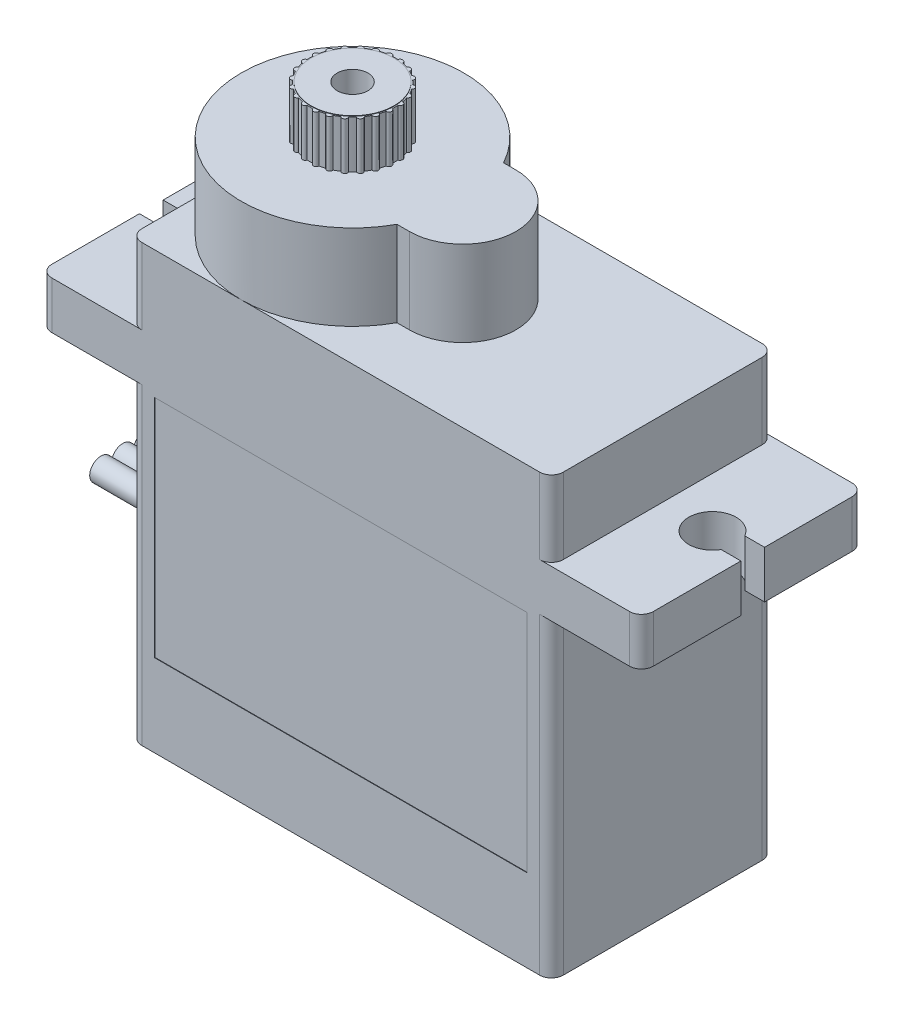
from build123d import *

# Parameters (mm, degrees)
SKETCH1_W               = 22.606
SKETCH1_H               = 11.938
BOSS_EXTRUDE1_DEPTH     = 23.368
SKETCH3_W               = 11.938
SKETCH3_H               = 2.54
BOSS_EXTRUDE2_DEPTH     = 16.129
BOSS_EXTRUDE3_DEPTH     = 4.572
CUT_EXTRUDE1_DEPTH      = 26.853781503
CUT_EXTRUDE1_DEPTH_BACK = 26.853781503
SKETCH6_R               = 2.413
SKETCH6_R_2             = 2.286
SKETCH6_R_3             = 0.8255
BOSS_EXTRUDE4_DEPTH     = 2.54
CUT_EXTRUDE2_START      = -2.54
CUT_EXTRUDE2_DEPTH      = 2.54
SKETCH9_R               = 2.2225
SKETCH9_R_2             = 0.8255
BOSS_EXTRUDE5_DEPTH     = 0.0254
FILLET1_R               = 0.635
FILLET2_R               = 0.635
SKETCH10_R              = 0.98425
CUT_EXTRUDE3_DEPTH      = 2.54
SKETCH11_R              = 0.60325
BOSS_EXTRUDE7_DEPTH     = 6.35
SKETCH13_W              = 19.9898
SKETCH13_H              = 12.0904
CUT_EXTRUDE4_DEPTH      = 0.0254


with BuildPart() as part:
    # Sketch1 → Boss-Extrude1 (new body)
    with BuildSketch(Plane(origin=(0, 0, 0), x_dir=(1, 0, 0), z_dir=(0, 1, 0))):
        Rectangle(SKETCH1_W, SKETCH1_H)
    extrude(amount=BOSS_EXTRUDE1_DEPTH)

    # Sketch3 → Boss-Extrude2 (add, symmetric)
    with BuildSketch(Plane(origin=(0, 0, 0), x_dir=(0, 0, -1), z_dir=(1, 0, 0))):
        with Locations((0, 18.034)):
            Rectangle(SKETCH3_W, SKETCH3_H)
    extrude(amount=BOSS_EXTRUDE2_DEPTH, both=True)

    # Sketch4 → Boss-Extrude3 (add)
    with BuildSketch(Plane(origin=(0, 23.368, 0), x_dir=(1, 0, 0), z_dir=(0, 1, 0))):
        with BuildLine():
            Line((0.5715, 2.8575), (-0.093422289, 2.8575))
            ThreePointArc((-0.093422289, 2.8575), (-11.303, 0), (-0.093422289, -2.8575))
            Line((-0.093422289, -2.8575), (0.5715, -2.8575))
            ThreePointArc((0.5715, -2.8575), (3.429, 0), (0.5715, 2.8575))
        make_face()
    extrude(amount=BOSS_EXTRUDE3_DEPTH)

    # Sketch5 → Cut-Extrude1 (cut, two sides: drawn at the far end of the back side and taken through both)
    with BuildSketch(Plane(origin=(0, 19.304, 0), x_dir=(1, 0, 0), z_dir=(0, 1, 0)).offset(-CUT_EXTRUDE1_DEPTH_BACK)):
        with BuildLine():
            ThreePointArc((-15.069852263, 0.635), (-12.7, 0), (-15.069852263, -0.635))
            Line((-15.069852263, -0.635), (-16.129, -0.635))
            Line((-16.129, -0.635), (-16.129, 0.635))
            Line((-16.129, 0.635), (-15.069852263, 0.635))
        make_face()
        with BuildLine():
            Line((16.129, -0.635), (16.129, 0.635))
            Line((16.129, 0.635), (15.069852263, 0.635))
            ThreePointArc((15.069852263, 0.635), (12.7, 0), (15.069852263, -0.635))
            Line((15.069852263, -0.635), (16.129, -0.635))
        make_face()
    extrude(amount=CUT_EXTRUDE1_DEPTH + CUT_EXTRUDE1_DEPTH_BACK, mode=Mode.SUBTRACT)

    # Sketch6 → Boss-Extrude4 (add)
    # profile 1 of 2: a face of its own
    with BuildSketch(Plane(origin=(0, 27.94, 0), x_dir=(1, 0, 0), z_dir=(0, 1, 0))):
        with Locations(Location((-5.334, 0, 0), (0, 0, 90))):
            Circle(SKETCH6_R)
        with Locations((-5.334, 0)):
            Circle(SKETCH6_R_2, mode=Mode.SUBTRACT)
    # profile 2 of 2: a face of its own
    with BuildSketch(Plane(origin=(0, 27.94, 0), x_dir=(1, 0, 0), z_dir=(0, 1, 0))):
        with Locations((-5.334, 0)):
            Circle(SKETCH6_R_2)
        with Locations(Location((-5.334, 0, 0), (0, 0, 90))):
            Circle(SKETCH6_R_3, mode=Mode.SUBTRACT)
    extrude(amount=BOSS_EXTRUDE4_DEPTH)

    # Sketch8 → Cut-Extrude2 (cut)
    with BuildSketch(Plane(origin=(0, 30.48, 0), x_dir=(1, 0, 0), z_dir=(0, 1, 0)).offset(CUT_EXTRUDE2_START)):
        with BuildLine():
            ThreePointArc((-6.841264533, 1.7187058), (-6.859086333, 1.823777663), (-6.802941328, 1.91436161))
            ThreePointArc((-6.802941328, 1.91436161), (-7.040248663, 1.706248663), (-7.24836161, 1.468941328))
            ThreePointArc((-7.24836161, 1.468941328), (-7.157777663, 1.525086333), (-7.0527058, 1.507264533))
            ThreePointArc((-7.0527058, 1.507264533), (-6.950446102, 1.616446102), (-6.841264533, 1.7187058))
        make_face()
        with BuildLine():
            ThreePointArc((-7.234739534, 1.270033553), (-7.279148669, 1.366912558), (-7.24836161, 1.468941328))
            ThreePointArc((-7.24836161, 1.468941328), (-7.423719299, 1.2065), (-7.563321312, 0.923415122))
            ThreePointArc((-7.563321312, 0.923415122), (-7.490355335, 1.001091883), (-7.384251087, 1.011071946))
            ThreePointArc((-7.384251087, 1.011071946), (-7.313734073, 1.143), (-7.234739534, 1.270033553))
        make_face()
        with BuildLine():
            ThreePointArc((-7.498682276, 0.734810618), (-7.566652339, 0.816894621), (-7.563321312, 0.923415122))
            ThreePointArc((-7.563321312, 0.923415122), (-7.664779019, 0.624530356), (-7.72635645, 0.314959702))
            ThreePointArc((-7.72635645, 0.314959702), (-7.675980953, 0.408874675), (-7.576075151, 0.445976476))
            ThreePointArc((-7.576075151, 0.445976476), (-7.542106439, 0.591660337), (-7.498682276, 0.734810618))
        make_face()
        with BuildLine():
            ThreePointArc((-7.615105499, 0.149511553), (-7.702004441, 0.211206665), (-7.72635645, 0.314959702))
            ThreePointArc((-7.72635645, 0.314959702), (-7.747, 0), (-7.72635645, -0.314959702))
            ThreePointArc((-7.72635645, -0.314959702), (-7.702004441, -0.211206665), (-7.615105499, -0.149511553))
            ThreePointArc((-7.615105499, -0.149511553), (-7.62, 0), (-7.615105499, 0.149511553))
        make_face()
        with BuildLine():
            ThreePointArc((-7.576075151, -0.445976476), (-7.675980953, -0.408874675), (-7.72635645, -0.314959702))
            ThreePointArc((-7.72635645, -0.314959702), (-7.664779019, -0.624530356), (-7.563321312, -0.923415122))
            ThreePointArc((-7.563321312, -0.923415122), (-7.566652339, -0.816894621), (-7.498682276, -0.734810618))
            ThreePointArc((-7.498682276, -0.734810618), (-7.542106439, -0.591660337), (-7.576075151, -0.445976476))
        make_face()
        with BuildLine():
            ThreePointArc((-7.384251087, -1.011071946), (-7.490355335, -1.001091883), (-7.563321312, -0.923415122))
            ThreePointArc((-7.563321312, -0.923415122), (-7.423719299, -1.2065), (-7.24836161, -1.468941328))
            ThreePointArc((-7.24836161, -1.468941328), (-7.279148669, -1.366912558), (-7.234739534, -1.270033553))
            ThreePointArc((-7.234739534, -1.270033553), (-7.313734073, -1.143), (-7.384251087, -1.011071946))
        make_face()
        with BuildLine():
            ThreePointArc((-7.0527058, -1.507264533), (-7.157777663, -1.525086333), (-7.24836161, -1.468941328))
            ThreePointArc((-7.24836161, -1.468941328), (-7.040248663, -1.706248663), (-6.802941328, -1.91436161))
            ThreePointArc((-6.802941328, -1.91436161), (-6.859086333, -1.823777663), (-6.841264533, -1.7187058))
            ThreePointArc((-6.841264533, -1.7187058), (-6.950446102, -1.616446102), (-7.0527058, -1.507264533))
        make_face()
        with BuildLine():
            ThreePointArc((-6.604033553, -1.900739534), (-6.700912558, -1.945148669), (-6.802941328, -1.91436161))
            ThreePointArc((-6.802941328, -1.91436161), (-6.5405, -2.089719299), (-6.257415122, -2.229321312))
            ThreePointArc((-6.257415122, -2.229321312), (-6.335091883, -2.156355335), (-6.345071946, -2.050251087))
            ThreePointArc((-6.345071946, -2.050251087), (-6.477, -1.979734073), (-6.604033553, -1.900739534))
        make_face()
        with BuildLine():
            ThreePointArc((-6.068810618, -2.164682276), (-6.150894621, -2.232652339), (-6.257415122, -2.229321312))
            ThreePointArc((-6.257415122, -2.229321312), (-5.958530356, -2.330779019), (-5.648959702, -2.39235645))
            ThreePointArc((-5.648959702, -2.39235645), (-5.742874675, -2.341980953), (-5.779976476, -2.242075151))
            ThreePointArc((-5.779976476, -2.242075151), (-5.925660337, -2.208106439), (-6.068810618, -2.164682276))
        make_face()
        with BuildLine():
            ThreePointArc((-5.648959702, -2.39235645), (-5.334, -2.413), (-5.019040298, -2.39235645))
            ThreePointArc((-5.019040298, -2.39235645), (-5.122793335, -2.368004441), (-5.184488447, -2.281105499))
            ThreePointArc((-5.184488447, -2.281105499), (-5.334, -2.286), (-5.483511553, -2.281105499))
            ThreePointArc((-5.483511553, -2.281105499), (-5.545206665, -2.368004441), (-5.648959702, -2.39235645))
        make_face()
        with BuildLine():
            ThreePointArc((-5.019040298, -2.39235645), (-4.709469644, -2.330779019), (-4.410584878, -2.229321312))
            ThreePointArc((-4.410584878, -2.229321312), (-4.517105379, -2.232652339), (-4.599189382, -2.164682276))
            ThreePointArc((-4.599189382, -2.164682276), (-4.742339663, -2.208106439), (-4.888023524, -2.242075151))
            ThreePointArc((-4.888023524, -2.242075151), (-4.925125325, -2.341980953), (-5.019040298, -2.39235645))
        make_face()
        with BuildLine():
            ThreePointArc((-4.410584878, -2.229321312), (-4.1275, -2.089719299), (-3.865058672, -1.91436161))
            ThreePointArc((-3.865058672, -1.91436161), (-3.967087442, -1.945148669), (-4.063966447, -1.900739534))
            ThreePointArc((-4.063966447, -1.900739534), (-4.191, -1.979734073), (-4.322928054, -2.050251087))
            ThreePointArc((-4.322928054, -2.050251087), (-4.332908117, -2.156355335), (-4.410584878, -2.229321312))
        make_face()
        with BuildLine():
            ThreePointArc((-3.865058672, -1.91436161), (-3.627751337, -1.706248663), (-3.41963839, -1.468941328))
            ThreePointArc((-3.41963839, -1.468941328), (-3.510222337, -1.525086333), (-3.6152942, -1.507264533))
            ThreePointArc((-3.6152942, -1.507264533), (-3.717553898, -1.616446102), (-3.826735467, -1.7187058))
            ThreePointArc((-3.826735467, -1.7187058), (-3.808913667, -1.823777663), (-3.865058672, -1.91436161))
        make_face()
        with BuildLine():
            ThreePointArc((-3.41963839, -1.468941328), (-3.244280701, -1.2065), (-3.104678688, -0.923415122))
            ThreePointArc((-3.104678688, -0.923415122), (-3.177644665, -1.001091883), (-3.283748913, -1.011071946))
            ThreePointArc((-3.283748913, -1.011071946), (-3.354265927, -1.143), (-3.433260466, -1.270033553))
            ThreePointArc((-3.433260466, -1.270033553), (-3.388851331, -1.366912558), (-3.41963839, -1.468941328))
        make_face()
        with BuildLine():
            ThreePointArc((-3.104678688, -0.923415122), (-3.003220981, -0.624530356), (-2.94164355, -0.314959702))
            ThreePointArc((-2.94164355, -0.314959702), (-2.992019047, -0.408874675), (-3.091924849, -0.445976476))
            ThreePointArc((-3.091924849, -0.445976476), (-3.125893561, -0.591660337), (-3.169317724, -0.734810618))
            ThreePointArc((-3.169317724, -0.734810618), (-3.101347661, -0.816894621), (-3.104678688, -0.923415122))
        make_face()
        with BuildLine():
            ThreePointArc((-2.921, 0), (-2.926166418, 0.157817751), (-2.94164355, 0.314959702))
            ThreePointArc((-2.94164355, 0.314959702), (-2.965995559, 0.211206665), (-3.052894501, 0.149511553))
            ThreePointArc((-3.052894501, 0.149511553), (-3.049223953, 0.074795823), (-3.048, 0))
            ThreePointArc((-3.048, 0), (-3.049223953, -0.074795823), (-3.052894501, -0.149511553))
            ThreePointArc((-3.052894501, -0.149511553), (-2.965995559, -0.211206665), (-2.94164355, -0.314959702))
            ThreePointArc((-2.94164355, -0.314959702), (-2.926166418, -0.157817751), (-2.921, 0))
        make_face()
        with BuildLine():
            ThreePointArc((-2.94164355, 0.314959702), (-3.003220981, 0.624530356), (-3.104678688, 0.923415122))
            ThreePointArc((-3.104678688, 0.923415122), (-3.101347661, 0.816894621), (-3.169317724, 0.734810618))
            ThreePointArc((-3.169317724, 0.734810618), (-3.125893561, 0.591660337), (-3.091924849, 0.445976476))
            ThreePointArc((-3.091924849, 0.445976476), (-2.992019047, 0.408874675), (-2.94164355, 0.314959702))
        make_face()
        with BuildLine():
            ThreePointArc((-3.104678688, 0.923415122), (-3.244280701, 1.2065), (-3.41963839, 1.468941328))
            ThreePointArc((-3.41963839, 1.468941328), (-3.388851331, 1.366912558), (-3.433260466, 1.270033553))
            ThreePointArc((-3.433260466, 1.270033553), (-3.354265927, 1.143), (-3.283748913, 1.011071946))
            ThreePointArc((-3.283748913, 1.011071946), (-3.177644665, 1.001091883), (-3.104678688, 0.923415122))
        make_face()
        with BuildLine():
            ThreePointArc((-3.41963839, 1.468941328), (-3.627751337, 1.706248663), (-3.865058672, 1.91436161))
            ThreePointArc((-3.865058672, 1.91436161), (-3.808913667, 1.823777663), (-3.826735467, 1.7187058))
            ThreePointArc((-3.826735467, 1.7187058), (-3.717553898, 1.616446102), (-3.6152942, 1.507264533))
            ThreePointArc((-3.6152942, 1.507264533), (-3.510222337, 1.525086333), (-3.41963839, 1.468941328))
        make_face()
        with BuildLine():
            ThreePointArc((-3.865058672, 1.91436161), (-4.1275, 2.089719299), (-4.410584878, 2.229321312))
            ThreePointArc((-4.410584878, 2.229321312), (-4.332908117, 2.156355335), (-4.322928054, 2.050251087))
            ThreePointArc((-4.322928054, 2.050251087), (-4.191, 1.979734073), (-4.063966447, 1.900739534))
            ThreePointArc((-4.063966447, 1.900739534), (-3.967087442, 1.945148669), (-3.865058672, 1.91436161))
        make_face()
        with BuildLine():
            ThreePointArc((-4.410584878, 2.229321312), (-4.709469644, 2.330779019), (-5.019040298, 2.39235645))
            ThreePointArc((-5.019040298, 2.39235645), (-4.925125325, 2.341980953), (-4.888023524, 2.242075151))
            ThreePointArc((-4.888023524, 2.242075151), (-4.742339663, 2.208106439), (-4.599189382, 2.164682276))
            ThreePointArc((-4.599189382, 2.164682276), (-4.517105379, 2.232652339), (-4.410584878, 2.229321312))
        make_face()
        with BuildLine():
            ThreePointArc((-5.184488447, 2.281105499), (-5.122793335, 2.368004441), (-5.019040298, 2.39235645))
            ThreePointArc((-5.019040298, 2.39235645), (-5.334, 2.413), (-5.648959702, 2.39235645))
            ThreePointArc((-5.648959702, 2.39235645), (-5.545206665, 2.368004441), (-5.483511553, 2.281105499))
            ThreePointArc((-5.483511553, 2.281105499), (-5.334, 2.286), (-5.184488447, 2.281105499))
        make_face()
        with BuildLine():
            ThreePointArc((-5.779976476, 2.242075151), (-5.742874675, 2.341980953), (-5.648959702, 2.39235645))
            ThreePointArc((-5.648959702, 2.39235645), (-5.958530356, 2.330779019), (-6.257415122, 2.229321312))
            ThreePointArc((-6.257415122, 2.229321312), (-6.150894621, 2.232652339), (-6.068810618, 2.164682276))
            ThreePointArc((-6.068810618, 2.164682276), (-5.925660337, 2.208106439), (-5.779976476, 2.242075151))
        make_face()
        with BuildLine():
            ThreePointArc((-6.345071946, 2.050251087), (-6.335091883, 2.156355335), (-6.257415122, 2.229321312))
            ThreePointArc((-6.257415122, 2.229321312), (-6.5405, 2.089719299), (-6.802941328, 1.91436161))
            ThreePointArc((-6.802941328, 1.91436161), (-6.700912558, 1.945148669), (-6.604033553, 1.900739534))
            ThreePointArc((-6.604033553, 1.900739534), (-6.477, 1.979734073), (-6.345071946, 2.050251087))
        make_face()
    extrude(amount=CUT_EXTRUDE2_DEPTH, mode=Mode.SUBTRACT)

    # Sketch9 → Boss-Extrude5 (add)
    with BuildSketch(Plane(origin=(0, 30.48, 0), x_dir=(1, 0, 0), z_dir=(0, 1, 0))):
        with Locations(Location((-5.334, 0, 0), (0, 0, 90))):
            Circle(SKETCH9_R)
        with Locations(Location((-5.334, 0, 0), (0, 0, 270))):
            Circle(SKETCH9_R_2, mode=Mode.SUBTRACT)
    extrude(amount=BOSS_EXTRUDE5_DEPTH)

    # Fillet1
    fillet1_edges = [part.edges().sort_by_distance(p)[0] for p in [
        (11.303, 8.382, 5.969),
        (-11.303, 8.382, 5.969),
        (-11.303, 8.382, -5.969),
        (11.303, 8.382, -5.969),
        (11.303, 21.336, 5.969),
        (-11.303, 21.336, 5.969),
        (-11.303, 21.336, -5.969),
        (11.303, 21.336, -5.969),
    ]]
    fillet(fillet1_edges, radius=FILLET1_R)

    # Fillet2
    fillet2_edges = [part.edges().sort_by_distance(p)[0] for p in [
        (-16.129, 18.034, 5.969),
        (-16.129, 18.034, -5.969),
        (16.129, 18.034, 5.969),
        (16.129, 18.034, -5.969),
    ]]
    fillet(fillet2_edges, radius=FILLET2_R)

    # Sketch10 → Cut-Extrude3 (cut)
    with BuildSketch(Plane.XZ):
        with Locations(Location((-10.16, 4.826, 0), (0, 0, 270))):
            Circle(SKETCH10_R)
        with Locations(Location((-10.16, -4.826, 0), (0, 0, 90))):
            Circle(SKETCH10_R)
        with Locations(Location((10.16, -4.826, 0), (0, 0, 270))):
            Circle(SKETCH10_R)
        with Locations(Location((10.16, 4.826, 0), (0, 0, 90))):
            Circle(SKETCH10_R)
    extrude(amount=-CUT_EXTRUDE3_DEPTH, mode=Mode.SUBTRACT)

    # Sketch11 → Boss-Extrude7 (add)
    with BuildSketch(Plane.ZY.offset(11.303)):
        with Locations((0, 6.95325)):
            Circle(SKETCH11_R)
        with Locations((-1.17475, 6.95325)):
            Circle(SKETCH11_R)
        with Locations((1.17475, 6.95325)):
            Circle(SKETCH11_R)
    extrude(amount=BOSS_EXTRUDE7_DEPTH)

    # Sketch13 → Cut-Extrude4 (cut)
    with BuildSketch(Plane.XY.offset(5.969)):
        with Locations((0, 10.4648)):
            Rectangle(SKETCH13_W, SKETCH13_H)
    extrude(amount=-CUT_EXTRUDE4_DEPTH, mode=Mode.SUBTRACT)


solid = part.part
